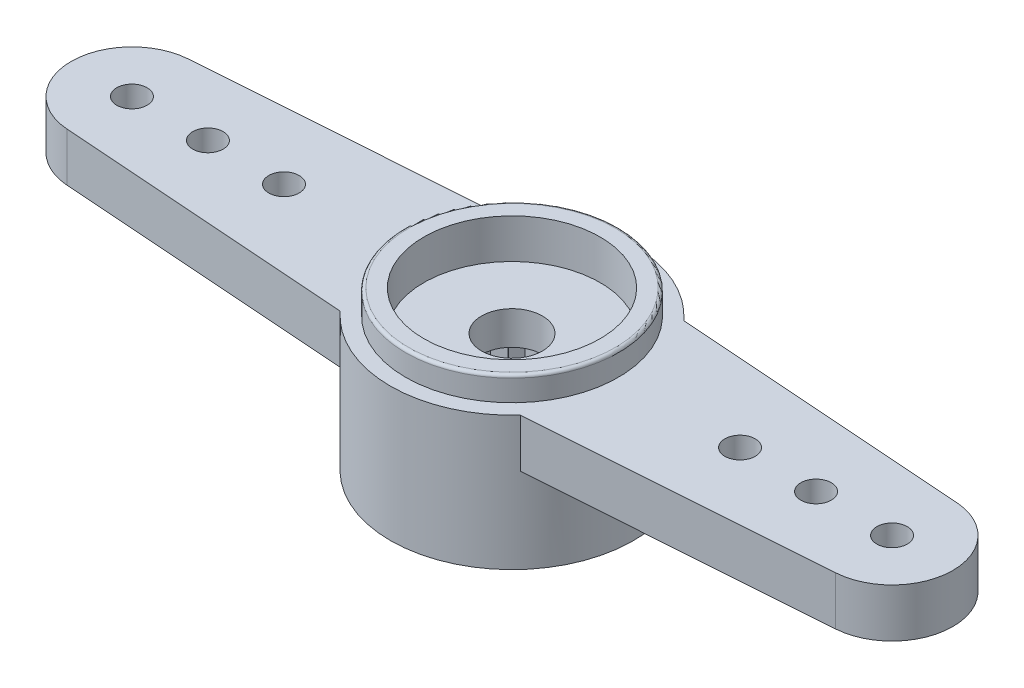
from build123d import *

# Parameters (mm, degrees)
SKETCH1_R           = 4
SKETCH1_R_2         = 2.6
BOSS_EXTRUDE1_DEPTH = 4.4
SKETCH2_R           = 0.5
SKETCH2_R_2         = 1
BOSS_EXTRUDE2_DEPTH = 1.6
SKETCH3_R           = 3.5
BOSS_EXTRUDE3_DEPTH = 0.8
SKETCH4_R           = 2.9
CUT_EXTRUDE1_DEPTH  = 1.3
FILLET1_R           = 0.1
CUT_EXTRUDE2_DEPTH  = 2.8
CIRPATTERN1_COUNT   = 23


with BuildPart() as part:
    # Sketch1 → Boss-Extrude1 (new body)
    with BuildSketch(Plane(origin=(0, 0, 0), x_dir=(1, 0, 0), z_dir=(0, 1, 0))):
        with Locations(Location((0, 0, 0), (0, 0, 270))):
            Circle(SKETCH1_R)
        with Locations(Location((0, 0, 0), (0, 0, 270))):
            Circle(SKETCH1_R_2, mode=Mode.SUBTRACT)
    extrude(amount=BOSS_EXTRUDE1_DEPTH)

    # Sketch2 → Boss-Extrude2 (add)
    with BuildSketch(Plane(origin=(0, 4.4, 0), x_dir=(1, 0, 0), z_dir=(0, 1, 0))):
        with BuildLine():
            Line((0, 2.9), (12.642815505, 1.994894416))
            ThreePointArc((12.642815505, 1.994894416), (14.5, 0), (12.642815505, -1.994894416))
            Line((12.642815505, -1.994894416), (0, -2.9))
            Line((0, -2.9), (-12.642815505, -1.994894416))
            ThreePointArc((-12.642815505, -1.994894416), (-14.5, 0), (-12.642815505, 1.994894416))
            Line((-12.642815505, 1.994894416), (0, 2.9))
        make_face()
        with Locations(Location((12.5, 0, 0), (0, 0, 270))):
            Circle(SKETCH2_R, mode=Mode.SUBTRACT)
        with Locations(Location((10, 0, 0), (0, 0, 270))):
            Circle(SKETCH2_R, mode=Mode.SUBTRACT)
        with Locations(Location((7.5, 0, 0), (0, 0, 270))):
            Circle(SKETCH2_R, mode=Mode.SUBTRACT)
        with Locations(Location((-7.5, 0, 0), (0, 0, 270))):
            Circle(SKETCH2_R, mode=Mode.SUBTRACT)
        with Locations(Location((-10, 0, 0), (0, 0, 270))):
            Circle(SKETCH2_R, mode=Mode.SUBTRACT)
        with Locations(Location((-12.5, 0, 0), (0, 0, 270))):
            Circle(SKETCH2_R, mode=Mode.SUBTRACT)
        with Locations(Location((0, 0, 0), (0, 0, 270))):
            Circle(SKETCH2_R_2, mode=Mode.SUBTRACT)
    extrude(amount=-BOSS_EXTRUDE2_DEPTH)

    # Sketch3 → Boss-Extrude3 (add)
    with BuildSketch(Plane(origin=(0, 4.4, 0), x_dir=(-1, 0, 0), z_dir=(0, -1, 0))):
        with Locations(Location((0, 0, 0), (0, 0, 90))):
            Circle(SKETCH3_R)
    extrude(amount=-BOSS_EXTRUDE3_DEPTH)

    # Sketch4 → Cut-Extrude1 (cut)
    with BuildSketch(Plane(origin=(0, 5.2, 0), x_dir=(1, 0, 0), z_dir=(0, 1, 0))):
        with Locations(Location((0, 0, 0), (0, 0, 270))):
            Circle(SKETCH4_R)
    extrude(amount=-CUT_EXTRUDE1_DEPTH, mode=Mode.SUBTRACT)

    # Fillet1
    fillet1_edges = [part.edges().sort_by_distance(p)[0] for p in [
        (0, 5.2, 3.5),
    ]]
    fillet(fillet1_edges, radius=FILLET1_R)

    # Sketch5 → Cut-Extrude2 (cut)
    with BuildSketch(Plane.XZ):
        Polygon((-0.466249863, 2.460177118), (0.466249863, 2.460177118), (0, 2.926426981), align=None)
    cut_extrude2 = extrude(amount=-CUT_EXTRUDE2_DEPTH, mode=Mode.SUBTRACT)

    # CirPattern1: Cut-Extrude2 ×23 about axis
    cirpattern1_axis = Axis((0, 0, 0), (0, 1, 0))
    for i in range(1, CIRPATTERN1_COUNT):
        add(cut_extrude2.rotate(cirpattern1_axis, i * 360 / CIRPATTERN1_COUNT), mode=Mode.SUBTRACT)


solid = part.part
